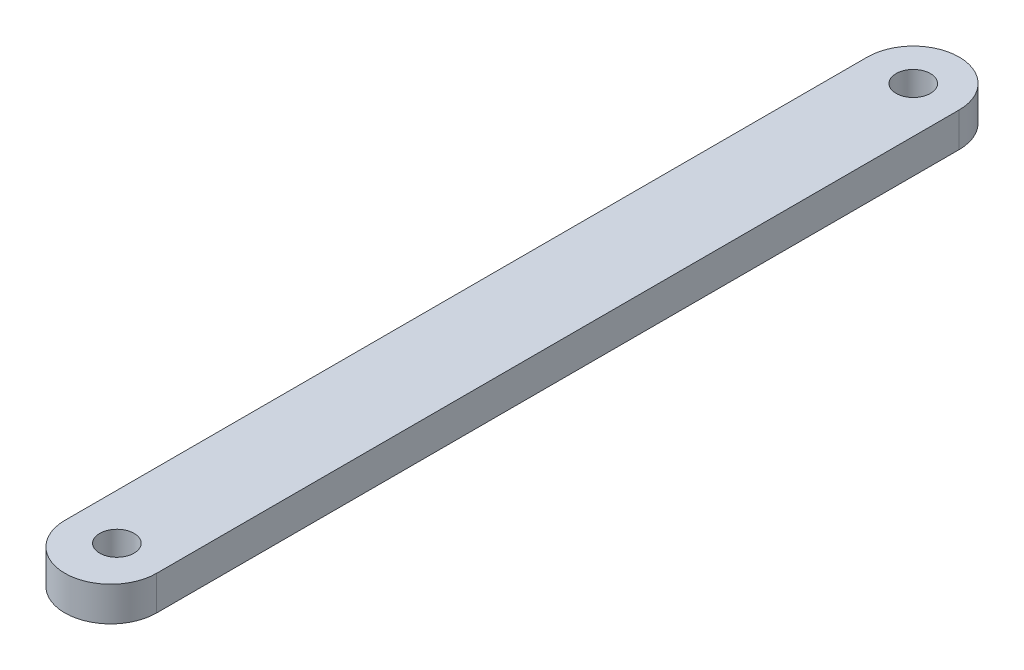
from build123d import *

# Parameters (mm, degrees)
CROQUIS1_R                 = 1.5
SALIENTE_EXTRUIR1_DEPTH    = 3
S_LIDO_MOVER_COPIAR1_ANGLE = 90


with BuildPart() as part:
    # Croquis1 → Saliente-Extruir1 (new body)
    with BuildSketch(Plane.XY):
        with BuildLine():
            Line((41815.543498545, -364.93949549), (41815.543498545, -434.93949549))
            ThreePointArc((41815.543498545, -434.93949549), (41811.543498545, -438.93949549), (41807.543498545, -434.93949549))
            Line((41807.543498545, -434.93949549), (41807.543498545, -364.93949549))
            ThreePointArc((41807.543498545, -364.93949549), (41811.543498545, -360.93949549), (41815.543498545, -364.93949549))
        make_face()
        with Locations((41811.543140326, -365.474822199)):
            Circle(CROQUIS1_R, mode=Mode.SUBTRACT)
        with Locations((41811.543498545, -434.93949549)):
            Circle(CROQUIS1_R, mode=Mode.SUBTRACT)
    extrude(amount=SALIENTE_EXTRUIR1_DEPTH)


with BuildPart() as part_1:
    # Sólido-Mover/Copiar1: moved
    add(part.part.rotate(Axis((0, -399.93949549, 1.5), (1, 0, 0)), S_LIDO_MOVER_COPIAR1_ANGLE))


solid = part_1.part
